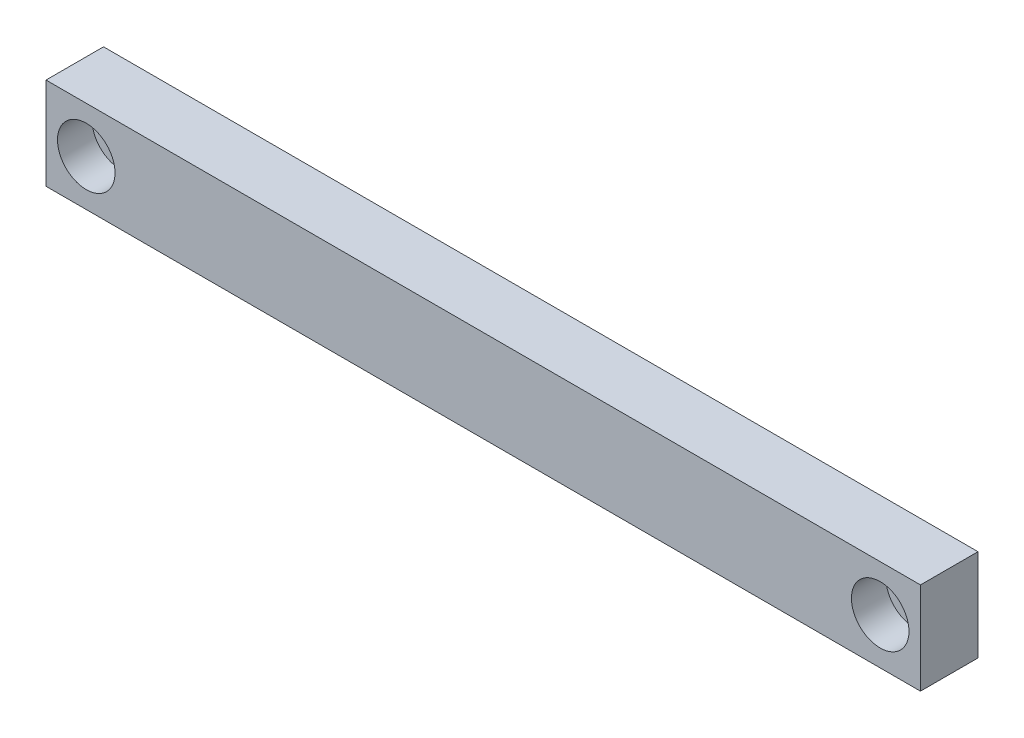
from build123d import *

# Parameters (mm, degrees)
SKETCH3_W           = 76
SKETCH3_H           = 8
SKETCH3_R           = 1.5
BOSS_EXTRUDE1_DEPTH = 5
SKETCH4_R           = 3
CUT_EXTRUDE1_DEPTH  = 3
SKETCH5_R           = 2.5
CUT_EXTRUDE2_DEPTH  = 3


with BuildPart() as part:
    # Sketch3 → Boss-Extrude1 (new body)
    with BuildSketch(Plane.XY.offset(4.5)):
        Rectangle(SKETCH3_W, SKETCH3_H)
        with Locations((-34.5, 0)):
            Circle(SKETCH3_R, mode=Mode.SUBTRACT)
        with Locations((34.5, 0)):
            Circle(SKETCH3_R, mode=Mode.SUBTRACT)
    extrude(amount=BOSS_EXTRUDE1_DEPTH)

    # Sketch4 → Cut-Extrude1 (cut)
    with BuildSketch(Plane(origin=(0, 0, 4.5), x_dir=(-1, 0, 0), z_dir=(0, 0, -1))):
        Circle(SKETCH4_R)
    extrude(amount=-CUT_EXTRUDE1_DEPTH, mode=Mode.SUBTRACT)

    # Sketch5 → Cut-Extrude2 (cut)
    with BuildSketch(Plane.XY.offset(9.5)):
        with Locations((34.5, 0)):
            Circle(SKETCH5_R)
        with Locations((-34.5, 0)):
            Circle(SKETCH5_R)
    extrude(amount=-CUT_EXTRUDE2_DEPTH, mode=Mode.SUBTRACT)


solid = part.part
